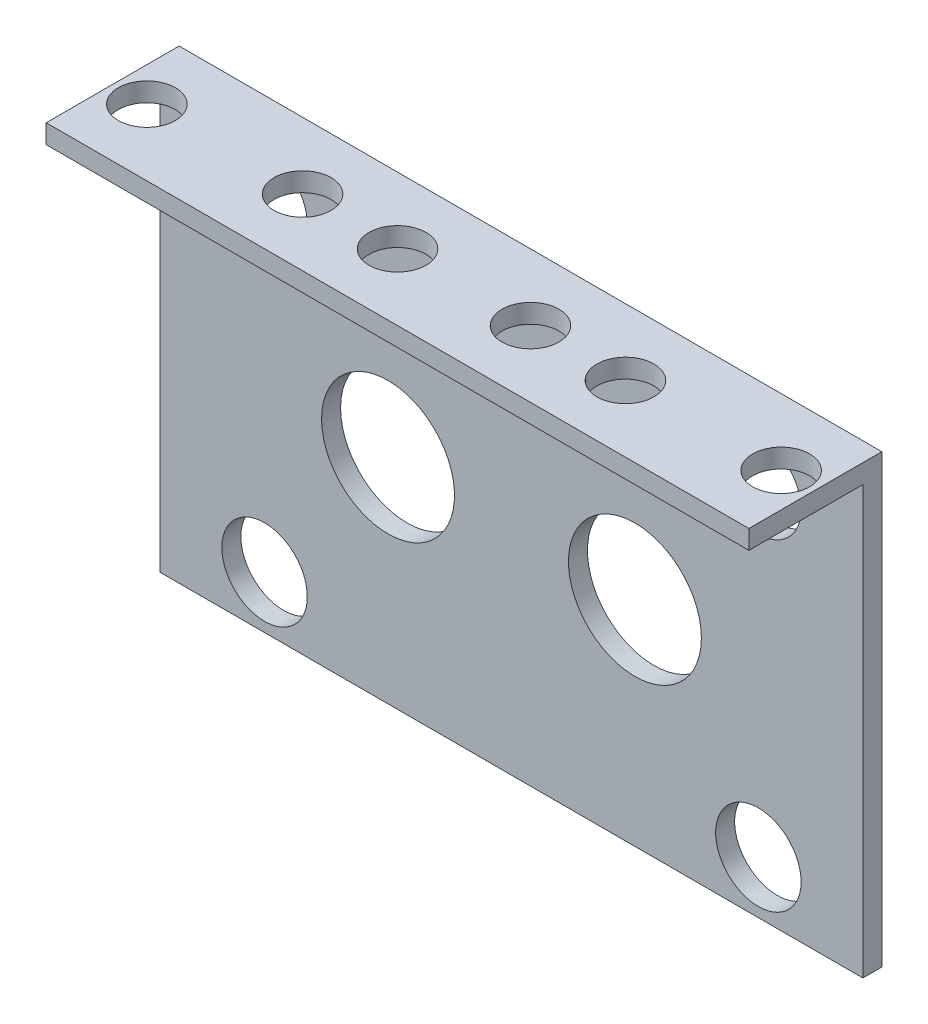
from build123d import *

# Parameters (mm, degrees)
ESBO_O1_W                = 37
ESBO_O1_H                = 22.5
RESSALTO_EXTRUS_O1_DEPTH = 1
ESBO_O2_R                = 2.25
ESBO_O2_R_2              = 3.5
CORTE_EXTRUS_O1_DEPTH    = 1
ESBO_O3_W                = 37
ESBO_O3_H                = 7
RESSALTO_EXTRUS_O2_DEPTH = 1
ESBO_O5_R                = 1.5
CORTE_EXTRUS_O2_DEPTH    = 1


with BuildPart() as part:
    # Esboço1 → Ressalto-extrusão1 (new body)
    with BuildSketch(Plane.XY):
        with Locations((18.5, 11.25)):
            Rectangle(ESBO_O1_W, ESBO_O1_H)
    extrude(amount=RESSALTO_EXTRUS_O1_DEPTH)

    # Esboço2 → Corte-extrusão1 (cut)
    with BuildSketch(Plane.XY.offset(1)):
        with Locations((5.5, 19.74)):
            Circle(ESBO_O2_R)
        with Locations((25, 11.25)):
            Circle(ESBO_O2_R_2)
        with Locations(Location((5.5, 2.76, 0), (0, 0, 180))):
            Circle(ESBO_O2_R)
        with Locations(Location((12, 11.25, 0), (0, 0, 180))):
            Circle(ESBO_O2_R_2)
        with Locations((31.5, 2.76)):
            Circle(ESBO_O2_R)
        with Locations(Location((31.5, 19.74, 0), (0, 0, 180))):
            Circle(ESBO_O2_R)
    extrude(amount=-CORTE_EXTRUS_O1_DEPTH, mode=Mode.SUBTRACT)

    # Esboço3 → Ressalto-extrusão2 (add)
    with BuildSketch(Plane(origin=(0, 22.5, 0), x_dir=(1, 0, 0), z_dir=(0, 1, 0))):
        with Locations((18.5, -3.5)):
            Rectangle(ESBO_O3_W, ESBO_O3_H)
    extrude(amount=RESSALTO_EXTRUS_O2_DEPTH)

    # Esboço5 → Corte-extrusão2 (cut)
    with BuildSketch(Plane(origin=(0, 23.5, 0), x_dir=(1, 0, 0), z_dir=(0, 1, 0))):
        with Locations(Location((1.8, -3.5, 0), (0, 0, 270))):
            Circle(ESBO_O5_R)
        with Locations(Location((10, -3.5, 0), (0, 0, 270))):
            Circle(ESBO_O5_R)
        with Locations(Location((15, -3.5, 0), (0, 0, 270))):
            Circle(ESBO_O5_R)
        with Locations(Location((22, -3.5, 0), (0, 0, 270))):
            Circle(ESBO_O5_R)
        with Locations(Location((27, -3.5, 0), (0, 0, 270))):
            Circle(ESBO_O5_R)
        with Locations(Location((35.2, -3.5, 0), (0, 0, 270))):
            Circle(ESBO_O5_R)
    extrude(amount=-CORTE_EXTRUS_O2_DEPTH, mode=Mode.SUBTRACT)


solid = part.part
